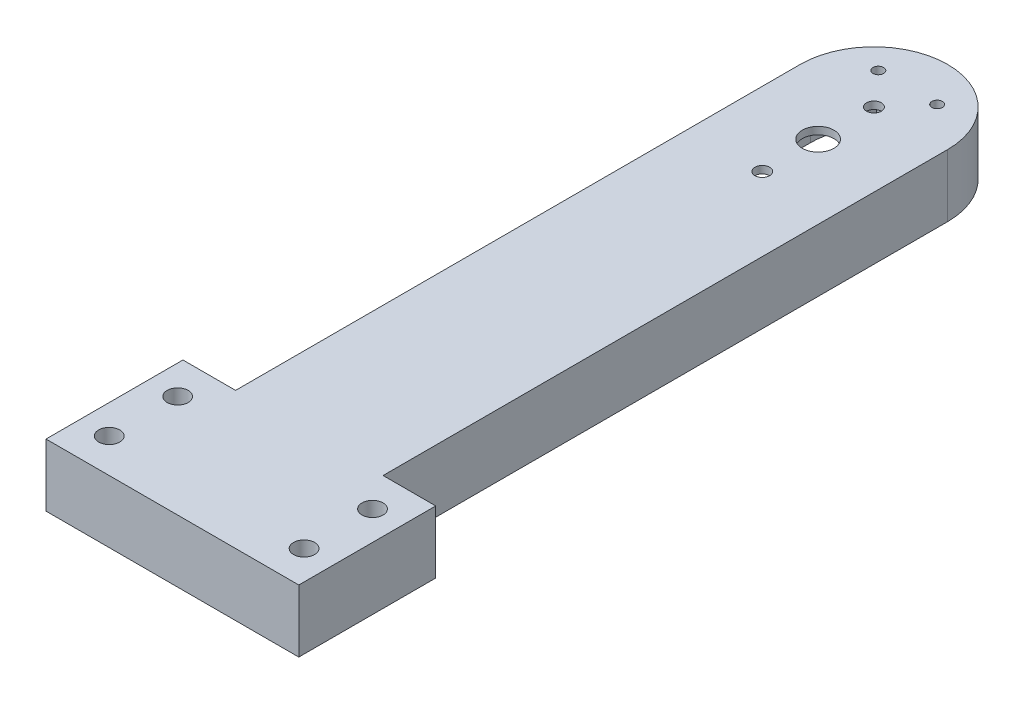
from build123d import *

# Parameters (mm, degrees)
BOSS_EXTRUDE1_DEPTH             = 10
BOSS_EXTRUDE2_START             = -3.5
SKETCH2_R                       = 3.5
SKETCH2_R_2                     = 7.5
BOSS_EXTRUDE2_DEPTH             = 3.5
BOSS_EXTRUDE3_REACH             = 247.545
BOSS_EXTRUDE3_DIRECTION_2_DEPTH = 19.65
SKETCH4_R                       = 2.5
CUT_EXTRUDE1_DEPTH              = 248.78291406
SKETCH5_W                       = 120
SKETCH5_H                       = 65
SKETCH5_R                       = 5
BOSS_EXTRUDE4_DEPTH             = 29.65
SKETCH6_W                       = 60
SKETCH6_H                       = 55
CUT_EXTRUDE2_DEPTH              = 19.65


with BuildPart() as part:
    # Sketch1 → Boss-Extrude1 (new body)
    with BuildSketch(Plane(origin=(0, 0, 0), x_dir=(1, 0, 0), z_dir=(0, 1, 0))):
        with BuildLine():
            Line((30, 26.5), (30, -243.5))
            Line((30, -243.5), (-30, -243.5))
            Line((-30, -243.5), (-30, 26.5))
            ThreePointArc((-30, 26.5), (0, 56.5), (30, 26.5))
        make_face()
        with BuildLine():
            ThreePointArc((11.477382224, -17.586065429), (21, 0), (11.477382224, 17.586065429))
            Line((11.477382224, 17.586065429), (5.68518373, 33.5))
            Line((5.68518373, 33.5), (-5.68518373, 33.5))
            Line((-5.68518373, 33.5), (-11.477382224, 17.586065429))
            ThreePointArc((-11.477382224, 17.586065429), (-21, 0), (-11.477382224, -17.586065429))
            Line((-11.477382224, -17.586065429), (-5.68518373, -33.5))
            Line((-5.68518373, -33.5), (5.68518373, -33.5))
            Line((5.68518373, -33.5), (11.477382224, -17.586065429))
        make_face(mode=Mode.SUBTRACT)
    extrude(amount=BOSS_EXTRUDE1_DEPTH)

    # Sketch2 → Boss-Extrude2 (add)
    with BuildSketch(Plane(origin=(0, 10, 0), x_dir=(1, 0, 0), z_dir=(0, 1, 0)).offset(BOSS_EXTRUDE2_START)):
        with BuildLine():
            Line((5.68518373, 33.5), (11.477382224, 17.586065429))
            ThreePointArc((11.477382224, 17.586065429), (21, 0), (11.477382224, -17.586065429))
            Line((11.477382224, -17.586065429), (5.68518373, -33.5))
            Line((5.68518373, -33.5), (-5.68518373, -33.5))
            Line((-5.68518373, -33.5), (-11.477382224, -17.586065429))
            ThreePointArc((-11.477382224, -17.586065429), (-21, 0), (-11.477382224, 17.586065429))
            Line((-11.477382224, 17.586065429), (-5.68518373, 33.5))
            Line((-5.68518373, 33.5), (5.68518373, 33.5))
        make_face()
        with Locations(Location((0, 26.5, 0), (0, 0, 270))):
            Circle(SKETCH2_R, mode=Mode.SUBTRACT)
        with Locations(Location((0, -26.5, 0), (0, 0, 90))):
            Circle(SKETCH2_R, mode=Mode.SUBTRACT)
        with Locations(Location((0, 0, 0), (0, 0, 270))):
            Circle(SKETCH2_R_2, mode=Mode.SUBTRACT)
    extrude(amount=BOSS_EXTRUDE2_DEPTH)

    # Boss-Extrude3: up to this face of the body (flat: up to its plane)
    boss_extrude3_end = Plane(part.part.faces().sort_by_distance((0, 10, 98.054911476))[0])
    # Sketch3 → Boss-Extrude3 (add, up to the picked face)
    with BuildSketch(Plane.XZ, mode=Mode.PRIVATE) as boss_extrude3_sk1:
        with BuildLine():
            Line((35, 243.5), (35, -26.5))
            ThreePointArc((35, -26.5), (0, -61.5), (-35, -26.5))
            Line((-35, -26.5), (-35, 243.5))
            Line((-35, 243.5), (-30, 243.5))
            Line((-30, 243.5), (-30, -26.5))
            ThreePointArc((-30, -26.5), (-29.473014303, -32.09834153), (-27.910571474, -37.5))
            Line((-27.910571474, -37.5), (27.910571474, -37.5))
            ThreePointArc((27.910571474, -37.5), (29.473014303, -32.09834153), (30, -26.5))
            Line((30, -26.5), (30, 243.5))
            Line((30, 243.5), (35, 243.5))
        make_face()
    boss_extrude3_tool1 = split(extrude(boss_extrude3_sk1.sketch, amount=-BOSS_EXTRUDE3_REACH, mode=Mode.PRIVATE), bisect_by=boss_extrude3_end, keep=Keep.BOTH, mode=Mode.PRIVATE)
    add(boss_extrude3_tool1.solids().sort_by(Axis((33.129297, 0, 108.5), (0, 1, 0)))[0])

    # Sketch3 → Boss-Extrude3 direction 2 (add)
    with BuildSketch(Plane.XZ):
        with BuildLine():
            Line((35, 243.5), (35, -26.5))
            ThreePointArc((35, -26.5), (0, -61.5), (-35, -26.5))
            Line((-35, -26.5), (-35, 243.5))
            Line((-35, 243.5), (-30, 243.5))
            Line((-30, 243.5), (-30, -26.5))
            ThreePointArc((-30, -26.5), (-29.473014303, -32.09834153), (-27.910571474, -37.5))
            Line((-27.910571474, -37.5), (27.910571474, -37.5))
            ThreePointArc((27.910571474, -37.5), (29.473014303, -32.09834153), (30, -26.5))
            Line((30, -26.5), (30, 243.5))
            Line((30, 243.5), (35, 243.5))
        make_face()
    extrude(amount=BOSS_EXTRUDE3_DIRECTION_2_DEPTH)

    # Sketch4 → Cut-Extrude1 (cut, through all)
    with BuildSketch(Plane.XZ.offset(19.65)):
        with Locations(Location((-13.955285737, -42.559356041, 0), (0, 0, 270))):
            Circle(SKETCH4_R)
        with Locations(Location((13.955285737, -42.559356041, 0), (0, 0, 270))):
            Circle(SKETCH4_R)
    extrude(amount=-CUT_EXTRUDE1_DEPTH, mode=Mode.SUBTRACT)

    # Sketch5 → Boss-Extrude4 (add)
    with BuildSketch(Plane(origin=(0, 10, 0), x_dir=(1, 0, 0), z_dir=(0, 1, 0))):
        with Locations((0, -274)):
            Rectangle(SKETCH5_W, SKETCH5_H)
        with Locations(Location((46.25, -290.25, 0), (0, 0, 270))):
            Circle(SKETCH5_R, mode=Mode.SUBTRACT)
        with Locations(Location((-46.25, -290.25, 0), (0, 0, 90))):
            Circle(SKETCH5_R, mode=Mode.SUBTRACT)
        with Locations(Location((46.25, -257.75, 0), (0, 0, 90))):
            Circle(SKETCH5_R, mode=Mode.SUBTRACT)
        with Locations(Location((-46.25, -257.75, 0), (0, 0, 270))):
            Circle(SKETCH5_R, mode=Mode.SUBTRACT)
    extrude(amount=-BOSS_EXTRUDE4_DEPTH)

    # Sketch6 → Cut-Extrude2 (cut)
    with BuildSketch(Plane.XZ.offset(19.65)):
        with Locations((0, 269)):
            Rectangle(SKETCH6_W, SKETCH6_H)
    extrude(amount=-CUT_EXTRUDE2_DEPTH, mode=Mode.SUBTRACT)


solid = part.part
